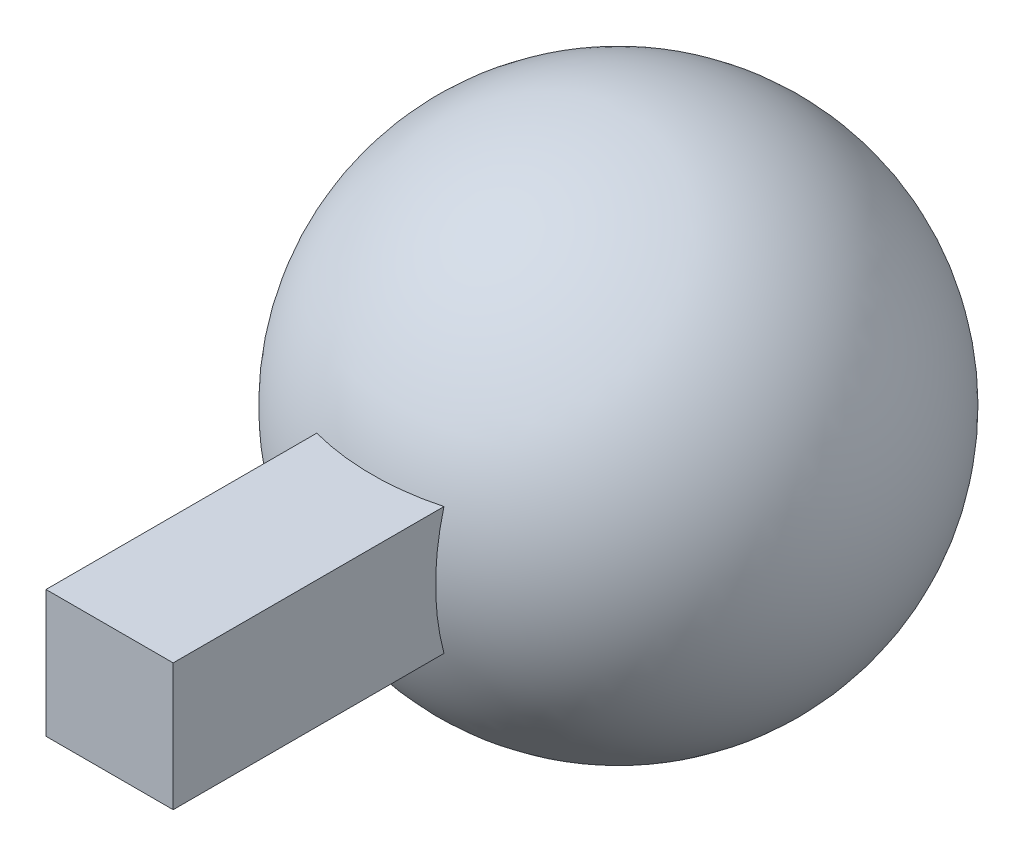
from build123d import *

# Parameters (mm, degrees)
ESQUISSE2_W        = 2
ESQUISSE2_H        = 2
BOSS_EXTRU_1_DEPTH = 8


with BuildPart() as part:
    # Esquisse1 → Révolution1 (revolve)
    with BuildSketch(Plane.XY):
        with BuildLine():
            Line((0, 4), (0, -4))
            ThreePointArc((0, -4), (-4, 0), (0, 4))
        make_face()
    revolve(axis=Axis((0, 4, 0), (0, -1, 0)))

    # Esquisse2 → Boss.-Extru.1 (add)
    with BuildSketch(Plane.XY):
        Rectangle(ESQUISSE2_W, ESQUISSE2_H)
    extrude(amount=BOSS_EXTRU_1_DEPTH)


solid = part.part
